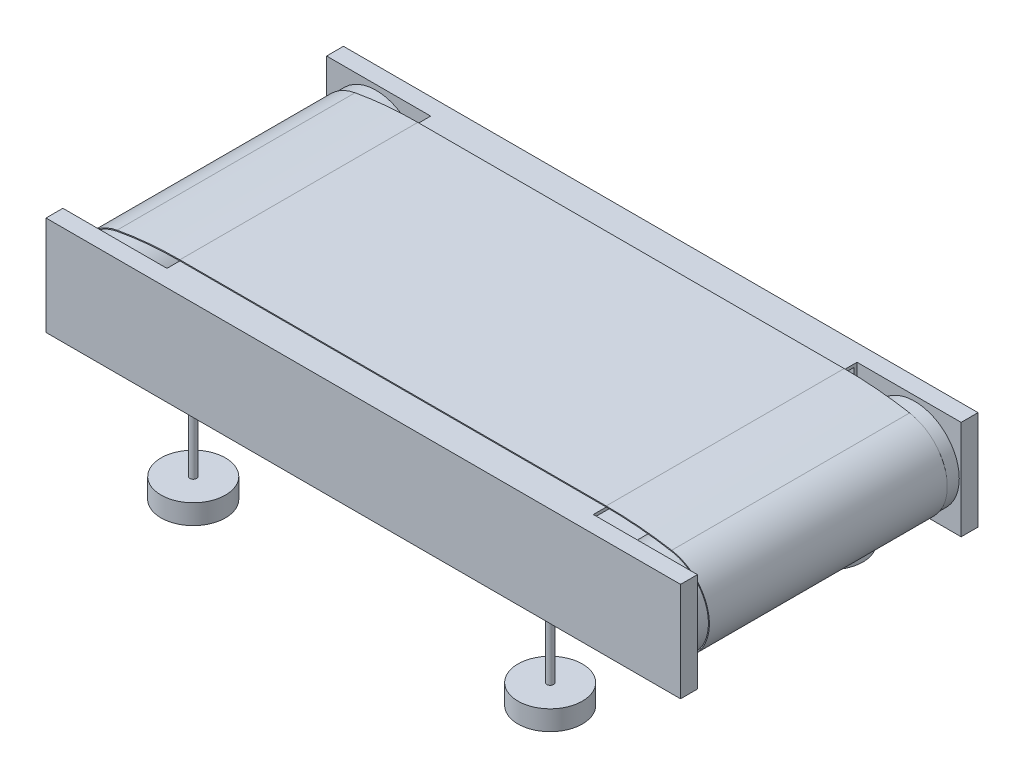
from build123d import *

# Parameters (mm, degrees)
CROQUIS1_W                = 640
CROQUIS1_H                = 100
SALIENTE_EXTRUIR1_DEPTH   = 150
CROQUIS2_W                = 105
CROQUIS2_H                = 266
CORTAR_EXTRUIR1_DEPTH     = 150
CROQUIS4_W                = 260
CROQUIS4_H                = 94
CORTAR_EXTRUIR2_DEPTH     = 565.557348726
CROQUIS5_R                = 3.5
SALIENTE_EXTRUIR2_DEPTH   = 80
CROQUIS6_R                = 32.5
SALIENTE_EXTRUIR3_DEPTH   = 20
SALIENTE_EXTRUIR3_2_DEPTH = 20
SALIENTE_EXTRUIR3_3_DEPTH = 20
SALIENTE_EXTRUIR3_4_DEPTH = 20
CROQUIS7_R                = 45
SALIENTE_EXTRUIR4_DEPTH   = 266
SALIENTE_EXTRUIR4_2_DEPTH = 266
SALIENTE_EXTRUIR6_START   = -30
SALIENTE_EXTRUIR6_DEPTH   = 240


with BuildPart() as part:
    # Croquis1 → Saliente-Extruir1 (new, symmetric)
    with BuildSketch(Plane.XY):
        with Locations((320, 50)):
            Rectangle(CROQUIS1_W, CROQUIS1_H)
    extrude(amount=SALIENTE_EXTRUIR1_DEPTH, both=True)

    # Croquis2 → Cortar-Extruir1 (cut, symmetric)
    with BuildSketch(Plane(origin=(0, 100, 0), x_dir=(1, 0, 0), z_dir=(0, 1, 0))):
        with Locations((52.5, 0)):
            Rectangle(CROQUIS2_W, CROQUIS2_H)
        with Locations((587.5, 0)):
            Rectangle(CROQUIS2_W, CROQUIS2_H)
    extrude(amount=CORTAR_EXTRUIR1_DEPTH, both=True, mode=Mode.SUBTRACT)

    # Croquis4 → Cortar-Extruir2 (cut, through all)
    with BuildSketch(Plane(origin=(535, 0, 0), x_dir=(0, 0, -1), z_dir=(1, 0, 0))):
        with Locations((0, 50)):
            Rectangle(CROQUIS4_W, CROQUIS4_H)
    extrude(amount=-CORTAR_EXTRUIR2_DEPTH, mode=Mode.SUBTRACT)

    # Croquis5 → Saliente-Extruir2 (add)
    with BuildSketch(Plane.XZ):
        with Locations(Location((140, 141.5, 0), (0, 0, 90))):
            Circle(CROQUIS5_R)
        with Locations(Location((140, -141.5, 0), (0, 0, 90))):
            Circle(CROQUIS5_R)
        with Locations(Location((500, -141.5, 0), (0, 0, 90))):
            Circle(CROQUIS5_R)
        with Locations(Location((500, 141.5, 0), (0, 0, 90))):
            Circle(CROQUIS5_R)
    extrude(amount=SALIENTE_EXTRUIR2_DEPTH)


with BuildPart() as body_2:
    # Croquis6 → Saliente-Extruir3 (new body)
    with BuildSketch(Plane.XZ.offset(80)):
        with Locations(Location((500, 141.5, 0), (0, 0, 270))):
            Circle(CROQUIS6_R)
    extrude(amount=-SALIENTE_EXTRUIR3_DEPTH)


with BuildPart() as body_3:
    # Croquis6 → Saliente-Extruir3 2 (new body)
    with BuildSketch(Plane.XZ.offset(80)):
        with Locations(Location((140, 141.5, 0), (0, 0, 90))):
            Circle(CROQUIS6_R)
    extrude(amount=-SALIENTE_EXTRUIR3_2_DEPTH)


with BuildPart() as body_4:
    # Croquis6 → Saliente-Extruir3 3 (new body)
    with BuildSketch(Plane.XZ.offset(80)):
        with Locations(Location((140, -141.5, 0), (0, 0, 270))):
            Circle(CROQUIS6_R)
    extrude(amount=-SALIENTE_EXTRUIR3_3_DEPTH)


with BuildPart() as body_5:
    # Croquis6 → Saliente-Extruir3 4 (new body)
    with BuildSketch(Plane.XZ.offset(80)):
        with Locations(Location((500, -141.5, 0), (0, 0, 90))):
            Circle(CROQUIS6_R)
    extrude(amount=-SALIENTE_EXTRUIR3_4_DEPTH)


with BuildPart() as body_6:
    # Croquis7 → Saliente-Extruir4 (new body)
    with BuildSketch(Plane.XY.offset(-133)):
        with Locations((593.117873857, 50)):
            Circle(CROQUIS7_R)
    extrude(amount=SALIENTE_EXTRUIR4_DEPTH)


with BuildPart() as body_7:
    # Croquis7 → Saliente-Extruir4 2 (new body)
    with BuildSketch(Plane.XY.offset(-133)):
        with Locations((50, 50)):
            Circle(CROQUIS7_R)
    extrude(amount=SALIENTE_EXTRUIR4_2_DEPTH)


with BuildPart() as body_8:
    # Croquis9 → Saliente-Extruir6 (new body)
    with BuildSketch(Plane.XY.offset(150).offset(SALIENTE_EXTRUIR6_START)):
        with BuildLine():
            Line((105, 101), (535, 101))
            ThreePointArc((535, 101), (568.144454941, 99.563357978), (601.040292744, 95.264208189))
            ThreePointArc((601.040292744, 95.264208189), (639.070167206, 50), (601.040292744, 4.735791811))
            ThreePointArc((601.040292744, 4.735791811), (568.144454941, 0.436642022), (535, -1))
            Line((535, -1), (105, -1))
            ThreePointArc((105, -1), (73.206254675, 0.447973976), (41.675742122, 4.779907567))
            ThreePointArc((41.675742122, 4.779907567), (4.020112779, 50), (41.675742122, 95.220092433))
            ThreePointArc((41.675742122, 95.220092433), (73.206254675, 99.552026024), (105, 101))
        make_face()
        with BuildLine():
            Line((105, 0), (535, 0))
            ThreePointArc((535, 0), (568.057927771, 1.432891513), (600.867887445, 5.720817908))
            ThreePointArc((600.867887445, 5.720817908), (638.070167206, 50), (600.867887445, 94.279182092))
            ThreePointArc((600.867887445, 94.279182092), (568.057927771, 98.567108487), (535, 100))
            Line((535, 100), (105, 100))
            ThreePointArc((105, 100), (73.297151603, 98.556165718), (41.856783407, 94.236616936))
            ThreePointArc((41.856783407, 94.236616936), (5.020112779, 50), (41.856783407, 5.763383064))
            ThreePointArc((41.856783407, 5.763383064), (73.297151603, 1.443834282), (105, 0))
        make_face(mode=Mode.SUBTRACT)
    extrude(amount=-SALIENTE_EXTRUIR6_DEPTH)


solid = Compound([part.part, body_2.part, body_3.part, body_4.part, body_5.part, body_6.part, body_7.part, body_8.part])
